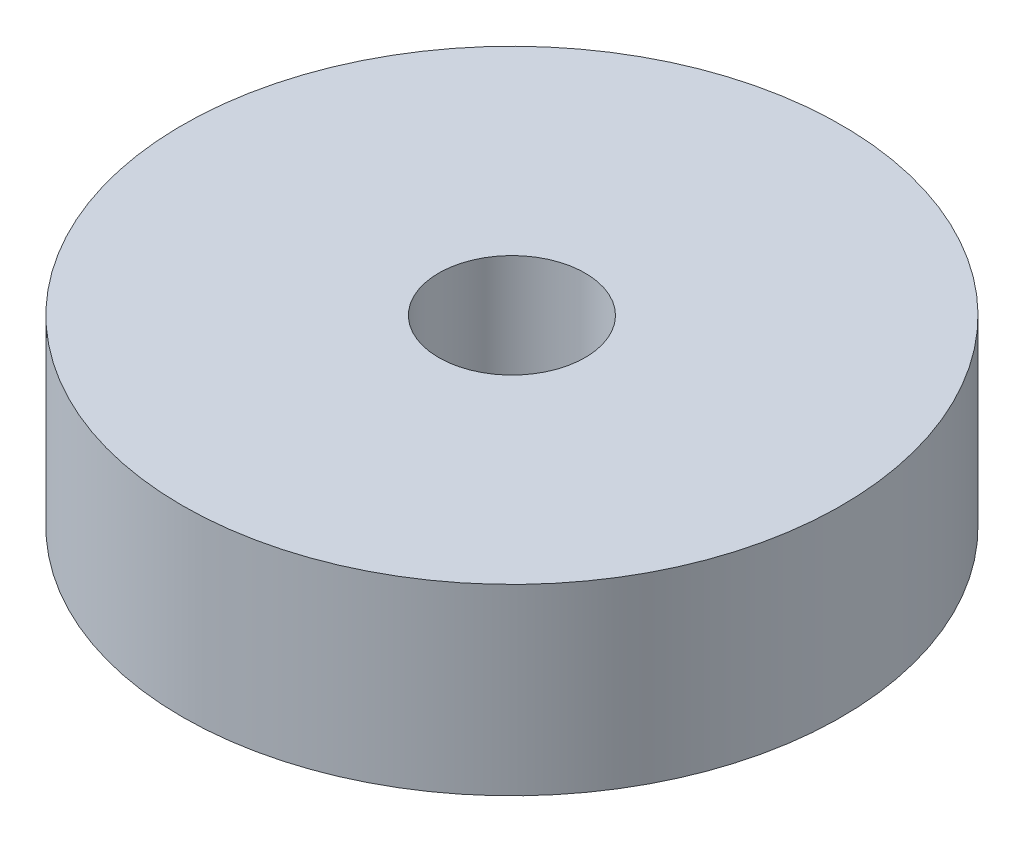
from build123d import *

# Parameters (mm, degrees)
SKETCH1_R           = 14.2875
SKETCH1_R_2         = 3.175
BOSS_EXTRUDE1_DEPTH = 7.9375


with BuildPart() as part:
    # Sketch1 → Boss-Extrude1 (new body)
    with BuildSketch(Plane(origin=(0, 0, 0), x_dir=(1, 0, 0), z_dir=(0, 1, 0))):
        with Locations(Location((0, 0, 0), (0, 0, 270))):
            Circle(SKETCH1_R)
        with Locations(Location((0, 0, 0), (0, 0, 270))):
            Circle(SKETCH1_R_2, mode=Mode.SUBTRACT)
    extrude(amount=BOSS_EXTRUDE1_DEPTH)


solid = part.part
